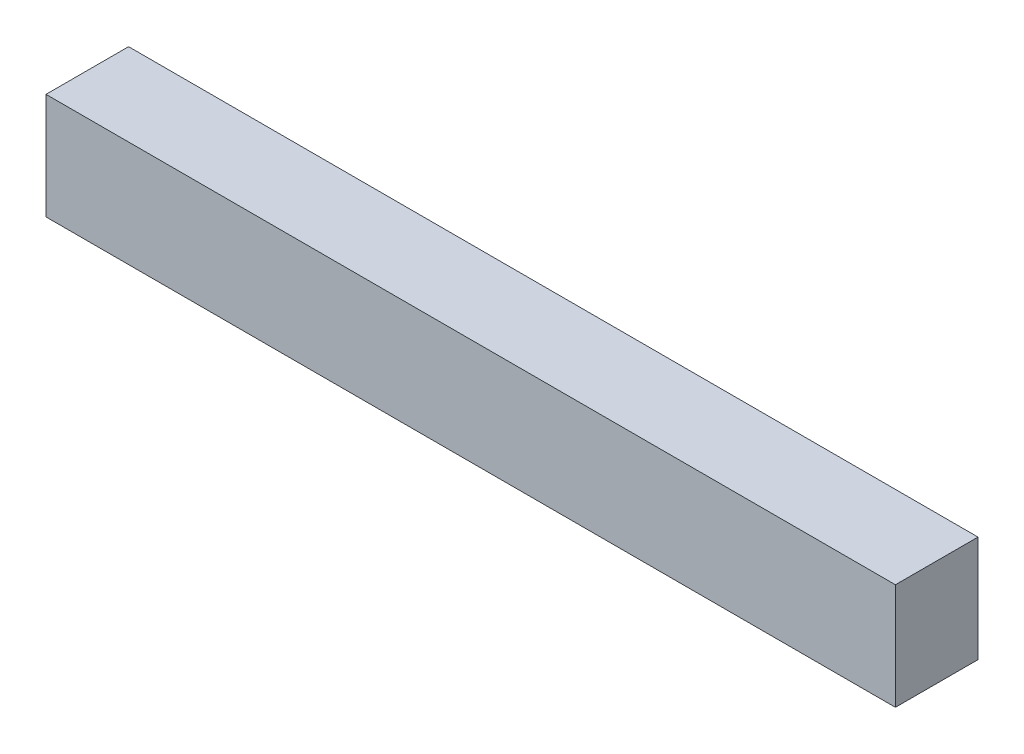
from build123d import *

# Parameters (mm, degrees)
SKETCH_1_W      = 360
SKETCH_1_H      = 45
EXTRUDE_1_DEPTH = 35


with BuildPart() as part:
    # 草图1 → 凸台-拉伸1 (new body)
    with BuildSketch(Plane.XY):
        Rectangle(SKETCH_1_W, SKETCH_1_H)
    extrude(amount=EXTRUDE_1_DEPTH)


solid = part.part
